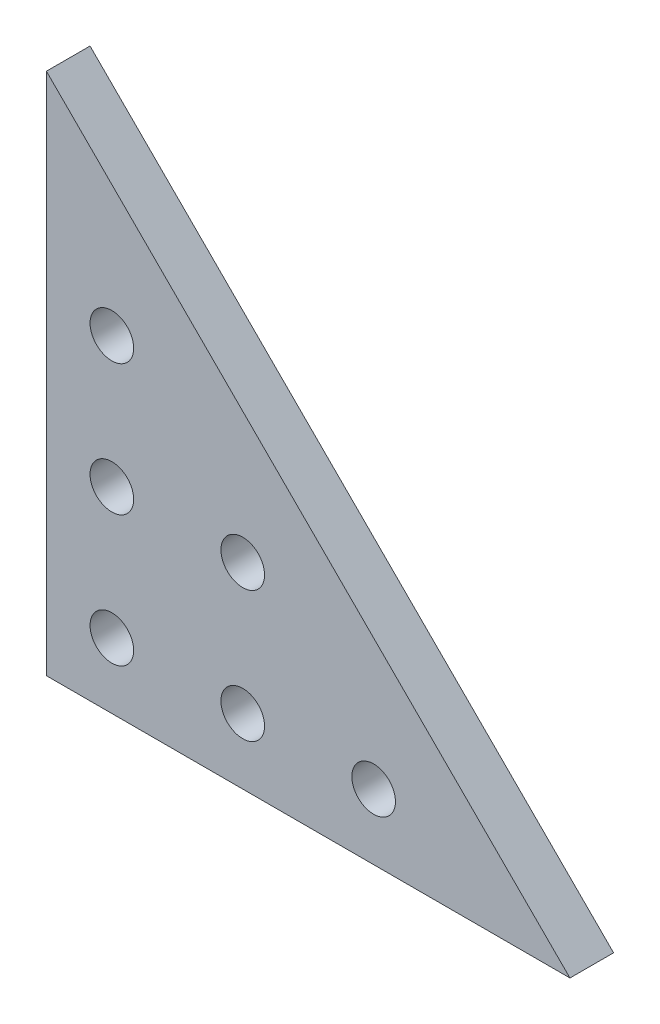
from build123d import *

# Parameters (mm, degrees)
MODEL_R                 = 1.5
SALIENTE_EXTRUIR1_DEPTH = 3


with BuildPart() as part:
    # Model → Saliente-Extruir1 (new body)
    with BuildSketch(Plane.XY):
        Polygon((-105.943383637, 105.556539338), (-105.943383637, 69.556539338), (-69.943383637, 69.556539338), align=None)
        with Locations((-101.443383637, 92.056539338)):
            Circle(MODEL_R, mode=Mode.SUBTRACT)
        with Locations((-101.443383637, 83.056539338)):
            Circle(MODEL_R, mode=Mode.SUBTRACT)
        with Locations((-92.443383637, 83.056539338)):
            Circle(MODEL_R, mode=Mode.SUBTRACT)
        with Locations((-101.443383637, 74.056539338)):
            Circle(MODEL_R, mode=Mode.SUBTRACT)
        with Locations((-92.443383637, 74.056539338)):
            Circle(MODEL_R, mode=Mode.SUBTRACT)
        with Locations((-83.443383637, 74.056539338)):
            Circle(MODEL_R, mode=Mode.SUBTRACT)
    extrude(amount=SALIENTE_EXTRUIR1_DEPTH)


solid = part.part
